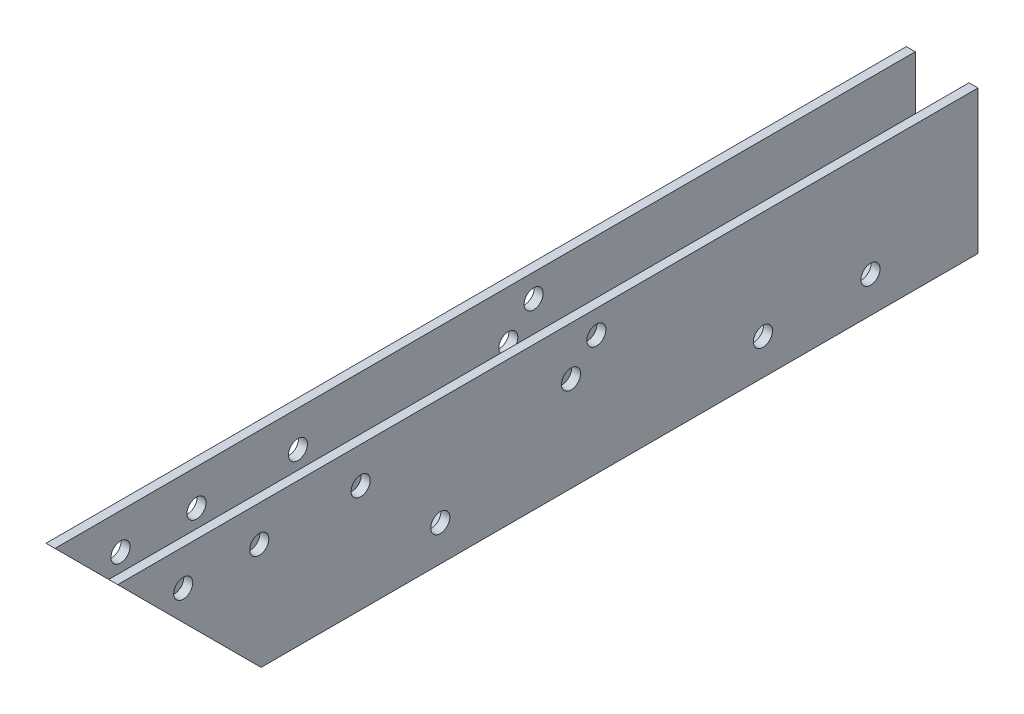
from build123d import *

# Parameters (mm, degrees)
BOSS_EXTRUDE2_DEPTH         = 152.4
CUT_EXTRUDE1_DEPTH          = 157.576115675
SKETCH5_R                   = 3.3782
CUT_EXTRUDE2_DEPTH          = 157.576115675
CUT_EXTRUDE3_REACH          = 158.576
SKETCH10_R                  = 3.3782
F_1_4_CLEARANCE_HOLE1_D     = 6.7564
F_1_4_CLEARANCE_HOLE1_DEPTH = 25.4
F_1_4_CLEARANCE_HOLE1_TIP   = 2.029827343


with BuildPart() as part:
    # Sketch3 → Boss-Extrude2 (new, symmetric)
    with BuildSketch(Plane.XY):
        Polygon((-12.7, 25.4), (-12.7, -25.4), (12.7, -25.4), (12.7, 25.4), (9.525, 25.4), (9.525, -22.225), (-9.525, -22.225), (-9.525, 25.4), align=None)
    extrude(amount=BOSS_EXTRUDE2_DEPTH, both=True)

    # Sketch4 → Cut-Extrude1 (cut, through all)
    with BuildSketch(Plane(origin=(12.7, 0, 0), x_dir=(0, 0, -1), z_dir=(1, 0, 0))):
        Polygon((-152.4, 25.4), (-101.6, -25.4), (-152.4, -25.4), align=None)
    extrude(amount=-CUT_EXTRUDE1_DEPTH, mode=Mode.SUBTRACT)

    # Sketch5 → Cut-Extrude2 (cut, through all)
    with BuildSketch(Plane.ZY.offset(12.7)):
        with Locations(Location((-8.209871939, 8.209871939, 0), (0, 0, 270))):
            Circle(SKETCH5_R)
        with Locations(Location((-17.190128061, 17.190128061, 0), (0, 0, 270))):
            Circle(SKETCH5_R)
    extrude(amount=-CUT_EXTRUDE2_DEPTH, mode=Mode.SUBTRACT)

    # Cut-Extrude3: up to this face of the body (flat: up to its plane)
    cut_extrude3_end = Plane(part.part.faces().sort_by_distance((12.7, 0.709119442, -12.313197401))[0])
    # Sketch10 → Cut-Extrude3 (cut, up to the picked face)
    with BuildSketch(Plane.ZY.offset(12.7), mode=Mode.PRIVATE) as cut_extrude3_sk1:
        with Locations(Location((66.317182668, 12.7, 0), (0, 0, 270))):
            Circle(SKETCH10_R)
    cut_extrude3_tool1 = split(extrude(cut_extrude3_sk1.sketch, amount=-CUT_EXTRUDE3_REACH, mode=Mode.PRIVATE), bisect_by=cut_extrude3_end, keep=Keep.BOTH, mode=Mode.PRIVATE)
    # Sketch10 → Cut-Extrude3 (cut, up to the picked face)
    with BuildSketch(Plane.ZY.offset(12.7), mode=Mode.PRIVATE) as cut_extrude3_sk2:
        with Locations(Location((129.178975516, 12.7, 0), (0, 0, 270))):
            Circle(SKETCH10_R)
    cut_extrude3_tool2 = split(extrude(cut_extrude3_sk2.sketch, amount=-CUT_EXTRUDE3_REACH, mode=Mode.PRIVATE), bisect_by=cut_extrude3_end, keep=Keep.BOTH, mode=Mode.PRIVATE)
    # Sketch10 → Cut-Extrude3 (cut, up to the picked face)
    with BuildSketch(Plane.ZY.offset(12.7), mode=Mode.PRIVATE) as cut_extrude3_sk3:
        with Locations(Location((102.238207153, 12.7, 0), (0, 0, 270))):
            Circle(SKETCH10_R)
    cut_extrude3_tool3 = split(extrude(cut_extrude3_sk3.sketch, amount=-CUT_EXTRUDE3_REACH, mode=Mode.PRIVATE), bisect_by=cut_extrude3_end, keep=Keep.BOTH, mode=Mode.PRIVATE)
    add(cut_extrude3_tool1.solids().sort_by(Axis((-12.7, 12.7, 66.317183), (1, 0, 0)))[0], mode=Mode.SUBTRACT)
    add(cut_extrude3_tool2.solids().sort_by(Axis((-12.7, 12.7, 129.178976), (1, 0, 0)))[0], mode=Mode.SUBTRACT)
    add(cut_extrude3_tool3.solids().sort_by(Axis((-12.7, 12.7, 102.238207), (1, 0, 0)))[0], mode=Mode.SUBTRACT)

    # 1/4 Clearance Hole1
    with Locations(Plane.ZY.offset(12.7)):
        with Locations((38.1, -12.7), (-114.3, -12.7), (-76.2, -12.7)):
            Hole(F_1_4_CLEARANCE_HOLE1_D / 2, depth=F_1_4_CLEARANCE_HOLE1_DEPTH)
            with Locations((0, 0, -(F_1_4_CLEARANCE_HOLE1_DEPTH + F_1_4_CLEARANCE_HOLE1_TIP / 2))):  # 118° drill point
                Cone(0, F_1_4_CLEARANCE_HOLE1_D / 2, F_1_4_CLEARANCE_HOLE1_TIP, mode=Mode.SUBTRACT)


solid = part.part
